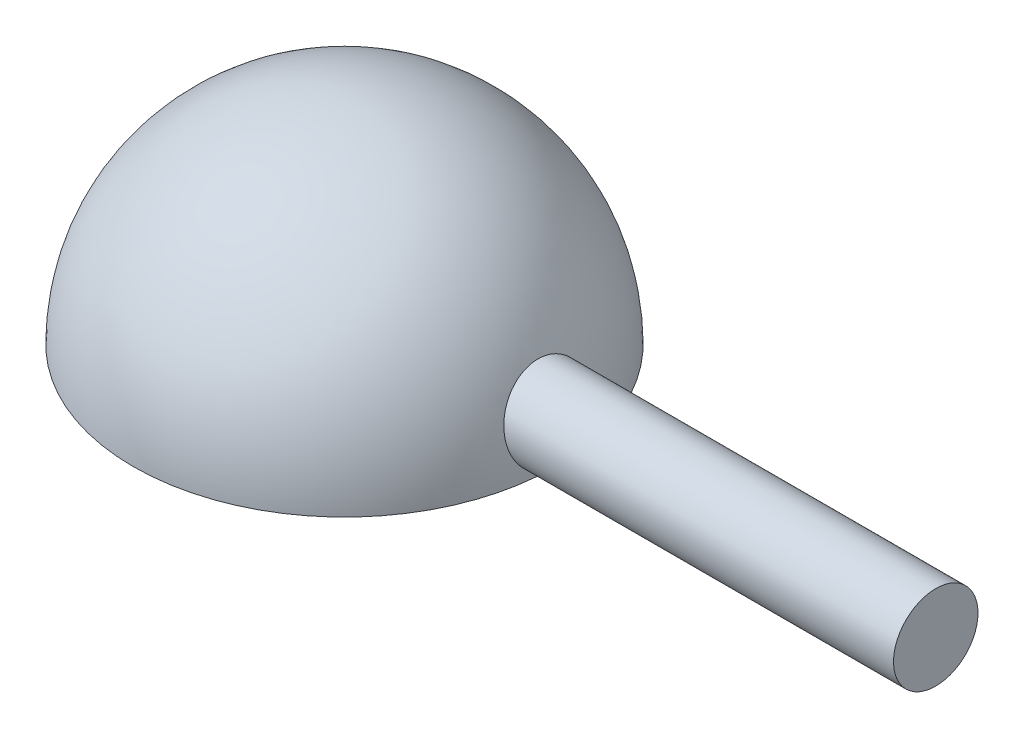
from build123d import *

# Parameters (mm, degrees)
CIRKEL_R                   = 5
ARM_DEPTH                  = 45
ARM_DIRECTION_2_REACH      = 63.237
ARM_DIRECTION_2_END_RADIUS = 25


with BuildPart() as part:
    # boog → bol (revolve)
    with BuildSketch(Plane.XY):
        with BuildLine():
            Line((-25, 0), (-22, 0))
            ThreePointArc((-22, 0), (-15.556349186, 15.556349186), (0, 22))
            Line((0, 22), (0, 25))
            ThreePointArc((0, 25), (-17.67766953, 17.67766953), (-25, 0))
        make_face()
    revolve(axis=Axis((0, 0, 0), (0, 1, 0)))

    # cirkel → arm (add)
    with BuildSketch(Plane(origin=(25, 0, 0), x_dir=(0, 0, -1), z_dir=(1, 0, 0))):
        with Locations((0, 5)):
            Circle(CIRKEL_R)
    extrude(amount=ARM_DEPTH)

    # arm direction 2: up to this sphere (the profile starts outside it)
    arm_direction_2_end = Location((0, 0, 0)) * Sphere(ARM_DIRECTION_2_END_RADIUS, mode=Mode.PRIVATE)
    # cirkel → arm direction 2 (add, up to the surface)
    with BuildSketch(Plane(origin=(25, 0, 0), x_dir=(0, 0, -1), z_dir=(1, 0, 0)), mode=Mode.PRIVATE) as arm_direction_2_sk1:
        with Locations((0, 5)):
            Circle(CIRKEL_R)
    arm_direction_2_tool1 = extrude(arm_direction_2_sk1.sketch, amount=-ARM_DIRECTION_2_REACH, mode=Mode.PRIVATE) - arm_direction_2_end
    add(arm_direction_2_tool1.solids().sort_by_distance((25, 5, 0))[0])


solid = part.part
